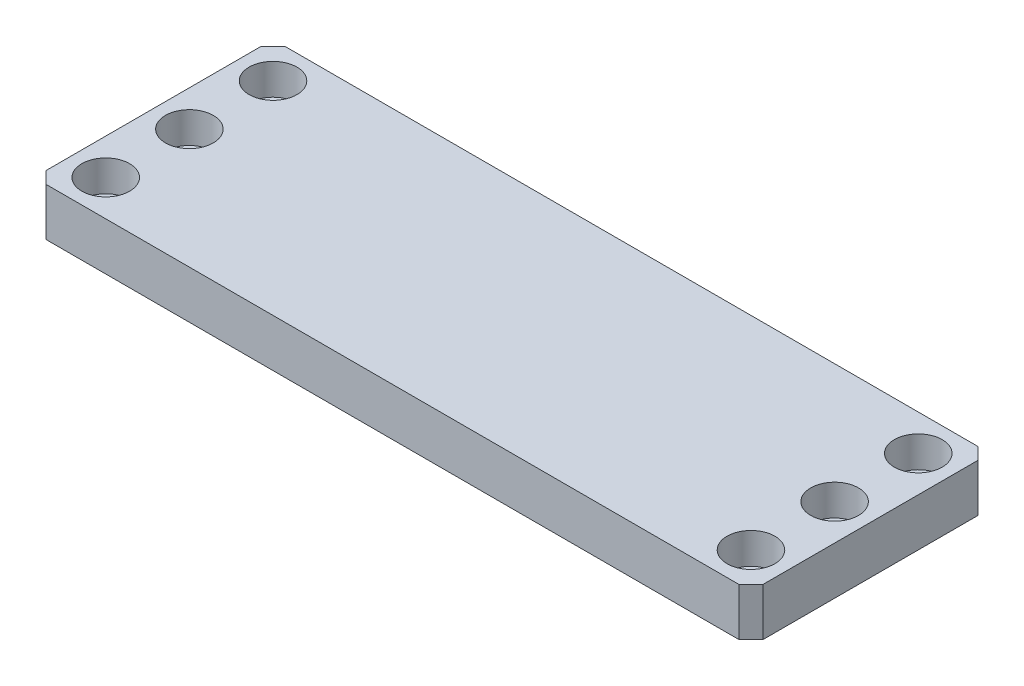
from build123d import *

# Parameters (mm, degrees)
SKETCH1_W                                            = 300
SKETCH1_H                                            = 100
BOSS_EXTRUDE1_DEPTH                                  = 20
CBORE_FOR_M12_HEXAGON_SOCKET_HEAD_CAP_SC_D           = 13.5
CBORE_FOR_M12_HEXAGON_SOCKET_HEAD_CAP_SC_CBORE_D     = 20
CBORE_FOR_M12_HEXAGON_SOCKET_HEAD_CAP_SC_CBORE_DEPTH = 13
CHAMFER1_SIZE                                        = 5
M8_TAPPED_HOLE1_D                                    = 6.8
M8_TAPPED_HOLE1_DEPTH                                = 15
M8_TAPPED_HOLE1_TIP                                  = 2.042926105


with BuildPart() as part:
    # Sketch1 → Boss-Extrude1 (new body)
    with BuildSketch(Plane(origin=(0, 0, 0), x_dir=(1, 0, 0), z_dir=(0, 1, 0))):
        Rectangle(SKETCH1_W, SKETCH1_H)
    extrude(amount=BOSS_EXTRUDE1_DEPTH)

    # CBORE for M12 Hexagon socket head cap screws1 (through all)
    with Locations(Plane(origin=(0, 20, 0), x_dir=(1, 0, 0), z_dir=(0, 1, 0))):
        with Locations((-135, 35), (-135, -35), (-135, 0), (135, 0), (135, -35), (135, 35)):
            CounterBoreHole(CBORE_FOR_M12_HEXAGON_SOCKET_HEAD_CAP_SC_D / 2, CBORE_FOR_M12_HEXAGON_SOCKET_HEAD_CAP_SC_CBORE_D / 2, CBORE_FOR_M12_HEXAGON_SOCKET_HEAD_CAP_SC_CBORE_DEPTH)

    # Chamfer1
    chamfer1_edges = [part.edges().sort_by_distance(p)[0] for p in [
        (-150, 10, -50),
        (150, 10, -50),
        (150, 10, 50),
        (-150, 10, 50),
    ]]
    chamfer(chamfer1_edges, length=CHAMFER1_SIZE)

    # M8 Tapped Hole1
    with Locations(Plane(origin=(0, 0, 0), x_dir=(-1, 0, 0), z_dir=(0, -1, 0))):
        with Locations((-37.8, 37.8), (37.8, 37.8), (37.8, -37.8), (-37.8, -37.8)):
            Hole(M8_TAPPED_HOLE1_D / 2, depth=M8_TAPPED_HOLE1_DEPTH)
            with Locations((0, 0, -(M8_TAPPED_HOLE1_DEPTH + M8_TAPPED_HOLE1_TIP / 2))):  # 118° drill point
                Cone(0, M8_TAPPED_HOLE1_D / 2, M8_TAPPED_HOLE1_TIP, mode=Mode.SUBTRACT)


solid = part.part
